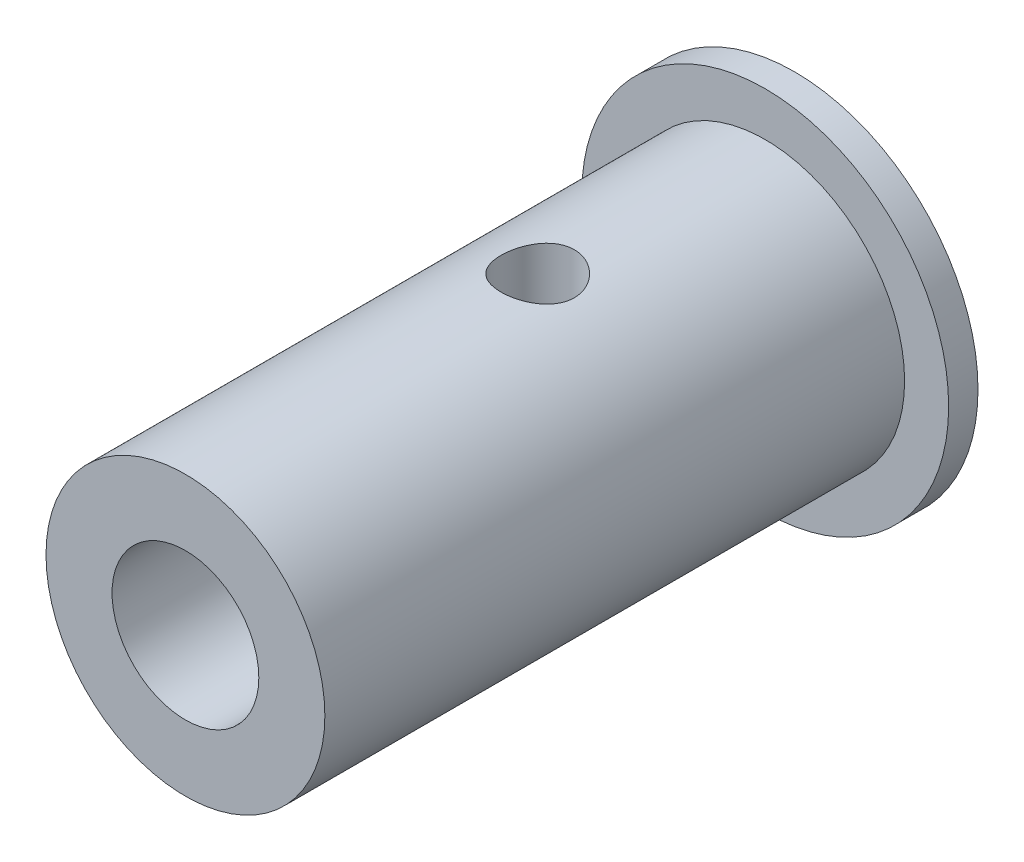
from build123d import *

# Parameters (mm, degrees)
SKETCH1_R           = 12.5
SKETCH1_R_2         = 9.5
BOSS_EXTRUDE1_DEPTH = 2
SKETCH1_3_R         = 9.5
SKETCH1_3_R_2       = 5
BOSS_EXTRUDE2_DEPTH = 41.5
CUT_EXTRUDE1_REACH  = 47.108
SKETCH2_R           = 2.5


with BuildPart() as part:
    # Sketch1 → Boss-Extrude1 (new body)
    with BuildSketch(Plane.XY):
        Circle(SKETCH1_R)
        Circle(SKETCH1_R_2, mode=Mode.SUBTRACT)
    extrude(amount=BOSS_EXTRUDE1_DEPTH)

    # Sketch1<3> → Boss-Extrude2 (add)
    with BuildSketch(Plane.XY):
        Circle(SKETCH1_3_R)
        Circle(SKETCH1_3_R_2, mode=Mode.SUBTRACT)
    extrude(amount=BOSS_EXTRUDE2_DEPTH)

    # Sketch2 → Cut-Extrude1 (cut, up to next)
    with BuildSketch(Plane(origin=(0, 0, 0), x_dir=(1, 0, 0), z_dir=(0, 1, 0)), mode=Mode.PRIVATE) as cut_extrude1_sk1:
        with Locations((0, -17.5)):
            Circle(SKETCH2_R)
    cut_extrude1_tool1 = extrude(cut_extrude1_sk1.sketch, amount=CUT_EXTRUDE1_REACH, mode=Mode.PRIVATE) & part.part
    add(cut_extrude1_tool1.solids().sort_by_distance((0, 0, 17.5))[0], mode=Mode.SUBTRACT)


solid = part.part
